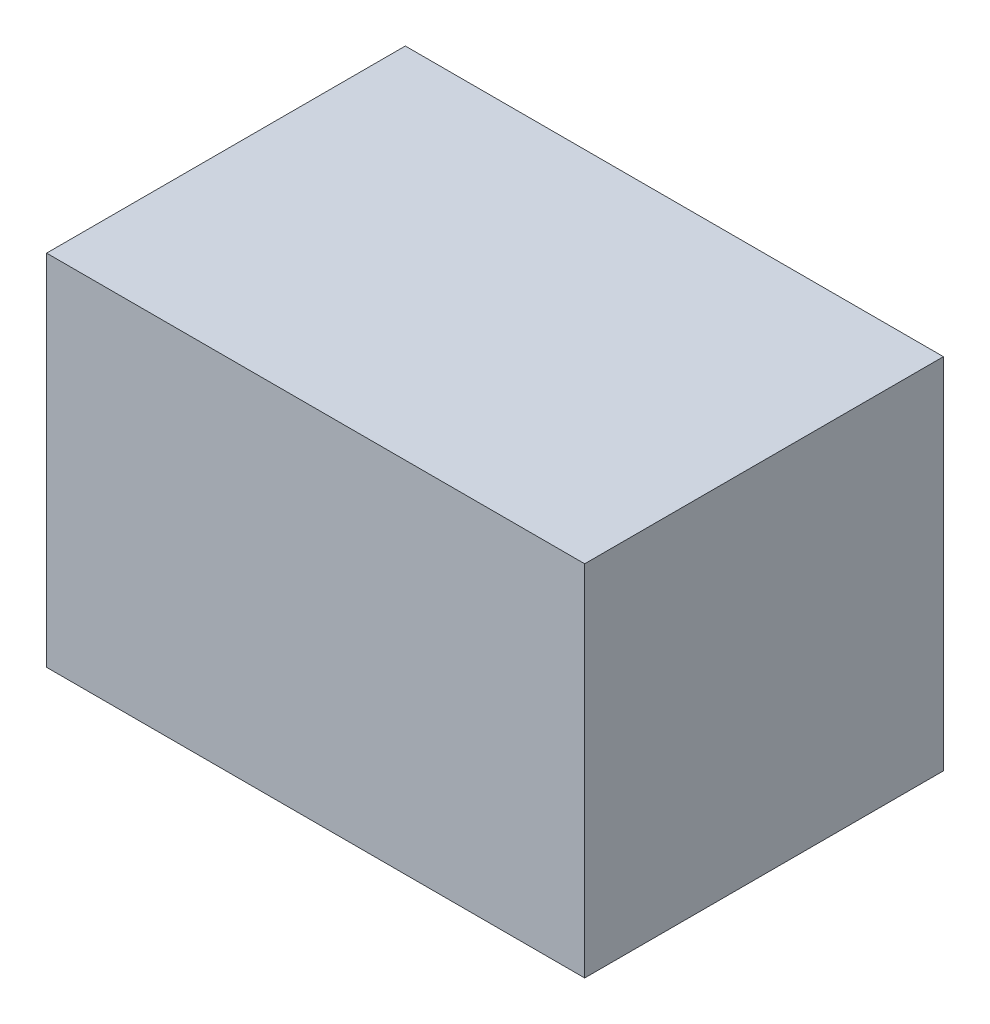
from build123d import *

# Parameters (mm, degrees)
SKETCH1_W           = 150
SKETCH1_H           = 100
BOSS_EXTRUDE1_DEPTH = 100


with BuildPart() as part:
    # Sketch1 → Boss-Extrude1 (new body)
    with BuildSketch(Plane.XY):
        with Locations((75, -50)):
            Rectangle(SKETCH1_W, SKETCH1_H)
    extrude(amount=BOSS_EXTRUDE1_DEPTH)


solid = part.part
